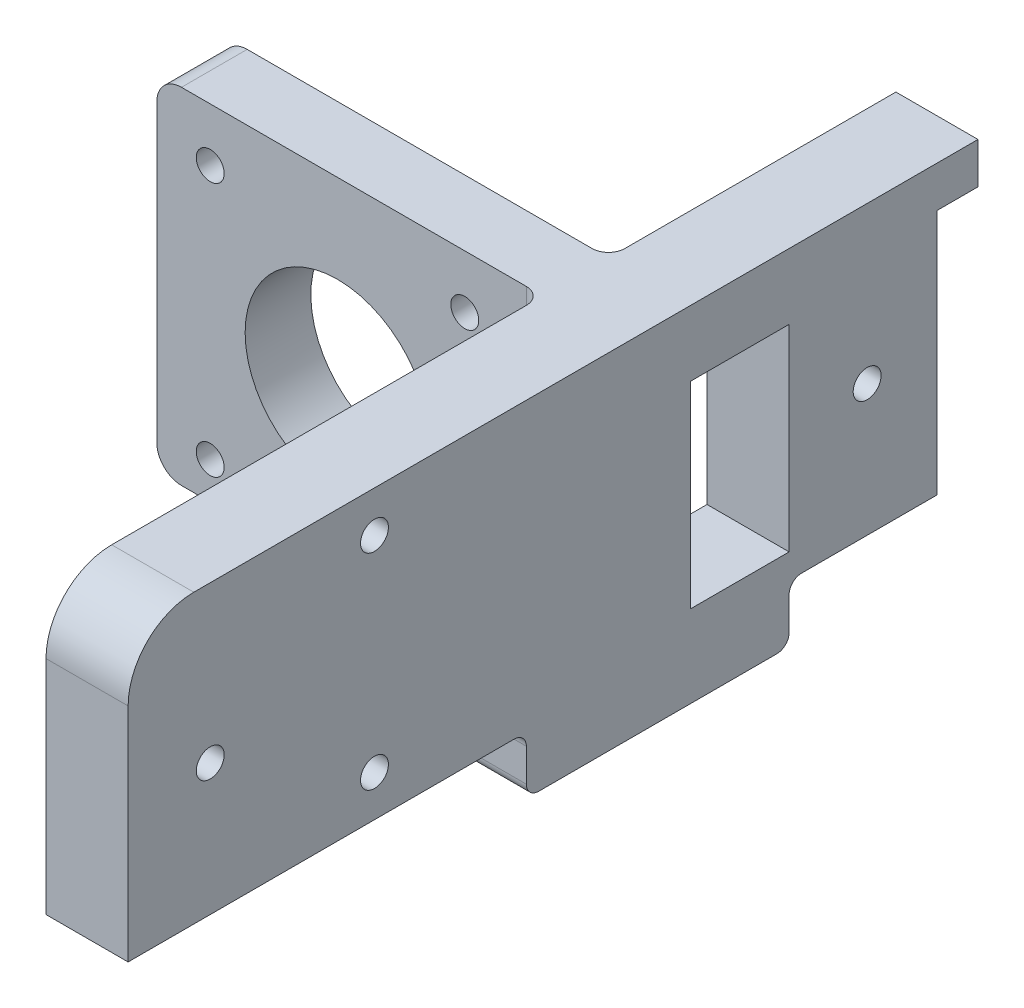
from build123d import *

# Parameters (mm, degrees)
BOSS_EXTRUDE1_DEPTH                                 = 10
CSK_FOR_M3_COUNTERSUNK_FLAT_HEAD_SCREW1_D           = 3.4
CSK_FOR_M3_COUNTERSUNK_FLAT_HEAD_SCREW1_CSINK_D     = 6.3
CSK_FOR_M3_COUNTERSUNK_FLAT_HEAD_SCREW1_CSINK_ANGLE = 90
SKETCH4_W                                           = 12
SKETCH4_H                                           = 24
CUT_EXTRUDE1_DEPTH                                  = 10
SKETCH6_W                                           = 32
SKETCH6_H                                           = 7
BOSS_EXTRUDE3_DEPTH                                 = 10
SKETCH7_W                                           = 8
SKETCH7_H                                           = 42
BOSS_EXTRUDE4_DEPTH                                 = 47
SKETCH8_R                                           = 11.25
CUT_EXTRUDE2_DEPTH                                  = 47
CSK_FOR_M3_COUNTERSUNK_FLAT_HEAD_SCREW2_D           = 3.4
CSK_FOR_M3_COUNTERSUNK_FLAT_HEAD_SCREW2_CSINK_D     = 6.3
CSK_FOR_M3_COUNTERSUNK_FLAT_HEAD_SCREW2_CSINK_ANGLE = 90
FILLET1_R                                           = 8
FILLET2_R                                           = 1.5
FILLET3_R                                           = 3
FILLET4_R                                           = 2


with BuildPart() as part:
    # Sketch1 → Boss-Extrude1 (new body)
    with BuildSketch(Plane(origin=(0, 0, 0), x_dir=(0, 0, -1), z_dir=(1, 0, 0))):
        Polygon((0, 0), (-98.5, 0), (-98.5, 35), (0, 35), (5, 35), (5, 30), (0, 30), align=None)
    extrude(amount=BOSS_EXTRUDE1_DEPTH)

    # CSK for M3 Countersunk Flat Head Screw1 (through all)
    with Locations(Plane(origin=(0, 16, 8.5), x_dir=(0, 0, -1), z_dir=(-1, 0, 0))):
        with Locations((0, 0), (-60, -14), (-60, 11), (-80, 0)):
            CounterSinkHole(CSK_FOR_M3_COUNTERSUNK_FLAT_HEAD_SCREW1_D / 2, CSK_FOR_M3_COUNTERSUNK_FLAT_HEAD_SCREW1_CSINK_D / 2, counter_sink_angle=CSK_FOR_M3_COUNTERSUNK_FLAT_HEAD_SCREW1_CSINK_ANGLE)

    # Sketch4 → Cut-Extrude1 (cut)
    with BuildSketch(Plane.ZY):
        with Locations((24, 15)):
            Rectangle(SKETCH4_W, SKETCH4_H)
    extrude(amount=-CUT_EXTRUDE1_DEPTH, mode=Mode.SUBTRACT)

    # Sketch6 → Boss-Extrude3 (add)
    with BuildSketch(Plane.ZY):
        with Locations((34, -3.5)):
            Rectangle(SKETCH6_W, SKETCH6_H)
    extrude(amount=-BOSS_EXTRUDE3_DEPTH)

    # Sketch7 → Boss-Extrude4 (add)
    with BuildSketch(Plane.ZY):
        with Locations((34, 14)):
            Rectangle(SKETCH7_W, SKETCH7_H)
    extrude(amount=BOSS_EXTRUDE4_DEPTH)

    # Sketch8 → Cut-Extrude2 (cut)
    with BuildSketch(Plane(origin=(0, 0, 30), x_dir=(-1, 0, 0), z_dir=(0, 0, -1))):
        with Locations(Location((25, 13, 0), (0, 0, 90))):
            Circle(SKETCH8_R)
    extrude(amount=-CUT_EXTRUDE2_DEPTH, mode=Mode.SUBTRACT)

    # CSK for M3 Countersunk Flat Head Screw2 (through all)
    with Locations(Plane(origin=(-9.5, 28.5, 30), x_dir=(0, -1, 0), z_dir=(0, 0, -1))):
        with Locations((0, 0), (0, 31), (31, 31), (31, 0)):
            CounterSinkHole(CSK_FOR_M3_COUNTERSUNK_FLAT_HEAD_SCREW2_D / 2, CSK_FOR_M3_COUNTERSUNK_FLAT_HEAD_SCREW2_CSINK_D / 2, counter_sink_angle=CSK_FOR_M3_COUNTERSUNK_FLAT_HEAD_SCREW2_CSINK_ANGLE)

    # Fillet1
    fillet1_edges = [part.edges().sort_by_distance(p)[0] for p in [
        (5, 35, 98.5),
    ]]
    fillet(fillet1_edges, radius=FILLET1_R)

    # Fillet2
    fillet2_edges = [part.edges().sort_by_distance(p)[0] for p in [
        (5, -7, 18),
        (5, 0, 18),
        (5, 0, 50),
        (5, -7, 50),
    ]]
    fillet(fillet2_edges, radius=FILLET2_R)

    # Fillet3
    fillet3_edges = [part.edges().sort_by_distance(p)[0] for p in [
        (-47, -7, 34),
        (-47, 35, 34),
    ]]
    fillet(fillet3_edges, radius=FILLET3_R)

    # Fillet4
    fillet4_edges = [part.edges().sort_by_distance(p)[0] for p in [
        (0, -2, 30),
        (0, 31, 30),
        (0, 14, 38),
    ]]
    fillet(fillet4_edges, radius=FILLET4_R)


solid = part.part
